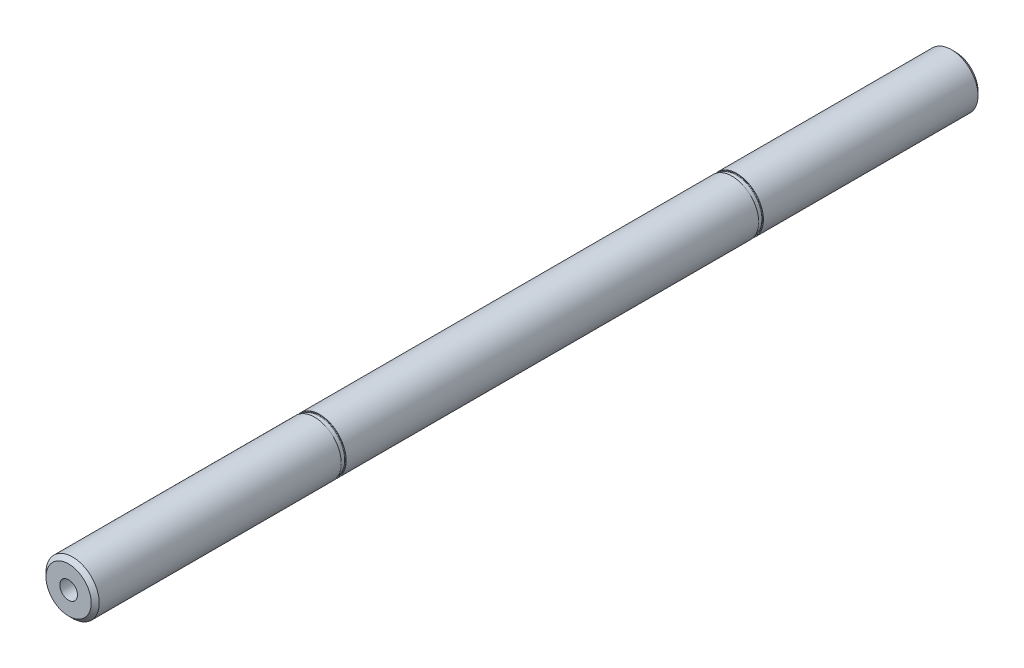
from build123d import *

# Parameters (mm, degrees)
SKETCH1_R           = 6
EXTRUDE1_DEPTH      = 100
CHAMFER1_SIZE       = 0.9
EXTRUDE3_DEPTH      = 101.359354322
EXTRUDE3_DEPTH_BACK = 101.359354322
SKETCH2_R           = 2


with BuildPart() as part:
    # Sketch1 → Extrude1 (new, symmetric)
    with BuildSketch(Plane.XY):
        Circle(SKETCH1_R)
    extrude(amount=EXTRUDE1_DEPTH, both=True)

    # Chamfer1
    chamfer1_edges = [part.edges().sort_by_distance(p)[0] for p in [
        (-6, 0, -100),
        (-6, 0, 100),
    ]]
    chamfer(chamfer1_edges, length=CHAMFER1_SIZE)

    # Sketch2 → Extrude3 (cut, two sides: drawn at the far end of the back side and taken through both)
    with BuildSketch(Plane.XY.offset(-EXTRUDE3_DEPTH_BACK)):
        Circle(SKETCH2_R)
    extrude(amount=EXTRUDE3_DEPTH + EXTRUDE3_DEPTH_BACK, mode=Mode.SUBTRACT)

    # Sketch5 → Groove for DIN 471 - 12 x 1_ Circlip for (revolve, cut)
    with BuildSketch(Plane(origin=(0, 0, 100), x_dir=(0, 1, 0), z_dir=(-1, 0, 0)), mode=Mode.PRIVATE) as groove_for_din_471_12_x_1_circlip_for_sk:
        with BuildLine():
            Line((5.86, 55.5), (7.2, 55.5))
            Line((7.2, 55.5), (7.2, 56.6))
            Line((7.2, 56.6), (5.86, 56.6))
            ThreePointArc((5.86, 56.6), (5.782218254, 56.567781746), (5.75, 56.49))
            Line((5.75, 56.49), (5.75, 55.61))
            ThreePointArc((5.75, 55.61), (5.782218254, 55.532218254), (5.86, 55.5))
        make_face()
    revolve(groove_for_din_471_12_x_1_circlip_for_sk.sketch.rotate(Axis((0, 0, 150), (0, 0, -1)), 270), axis=Axis((0, 0, 150), (0, 0, -1)), mode=Mode.SUBTRACT)

    # Sketch7 → Groove for DIN 471 - 12 x 1_ Circlip 2 (revolve, cut)
    with BuildSketch(Plane(origin=(0, 0, 100), x_dir=(0, 1, 0), z_dir=(-1, 0, 0)), mode=Mode.PRIVATE) as groove_for_din_471_12_x_1_circlip_2_sk:
        with BuildLine():
            Line((5.899017031, 149.607152194), (7.198150102, 150.1))
            Line((7.198150102, 150.1), (7.2, 150.7))
            Line((7.2, 150.7), (5.86, 150.7))
            ThreePointArc((5.86, 150.7), (5.782218254, 150.667781746), (5.75, 150.59))
            Line((5.75, 150.59), (5.75, 149.71))
            ThreePointArc((5.75, 149.71), (5.797517496, 149.619468587), (5.899017031, 149.607152194))
        make_face()
    revolve(groove_for_din_471_12_x_1_circlip_2_sk.sketch.rotate(Axis((0, 0, 150), (0, 0, -1)), 270), axis=Axis((0, 0, 150), (0, 0, -1)), mode=Mode.SUBTRACT)


solid = part.part
